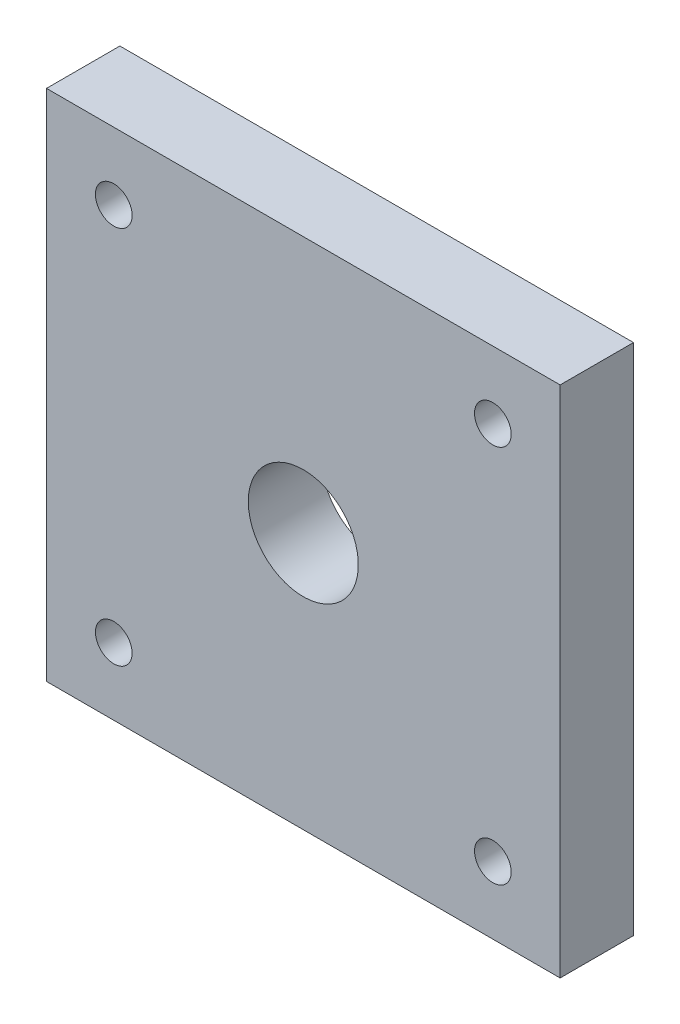
from build123d import *

# Parameters (mm, degrees)
SKETCH_1_W          = 42
SKETCH_1_H          = 42
EXTRUDE_1_DEPTH     = 6
SKETCH_2_R          = 1.5
CUT_EXTRUDE_1_DEPTH = 31.298514815
SKETCH_3_R          = 4.5
CUT_EXTRUDE_2_DEPTH = 31.298514815


with BuildPart() as part:
    # 草图1 → 凸台-拉伸1 (new body)
    with BuildSketch(Plane.XY):
        Rectangle(SKETCH_1_W, SKETCH_1_H)
    extrude(amount=EXTRUDE_1_DEPTH)

    # 草图2 → 切除-拉伸1 (cut, through all)
    with BuildSketch(Plane(origin=(0, 0, 0), x_dir=(-1, 0, 0), z_dir=(0, 0, -1))):
        with Locations((-15.5, 15.5)):
            Circle(SKETCH_2_R)
        with Locations((15.5, 15.5)):
            Circle(SKETCH_2_R)
        with Locations((15.5, -15.5)):
            Circle(SKETCH_2_R)
        with Locations((-15.5, -15.5)):
            Circle(SKETCH_2_R)
    extrude(amount=-CUT_EXTRUDE_1_DEPTH, mode=Mode.SUBTRACT)

    # 草图3 → 切除-拉伸2 (cut, through all)
    with BuildSketch(Plane(origin=(0, 0, 0), x_dir=(-1, 0, 0), z_dir=(0, 0, -1))):
        Circle(SKETCH_3_R)
    extrude(amount=-CUT_EXTRUDE_2_DEPTH, mode=Mode.SUBTRACT)


solid = part.part
